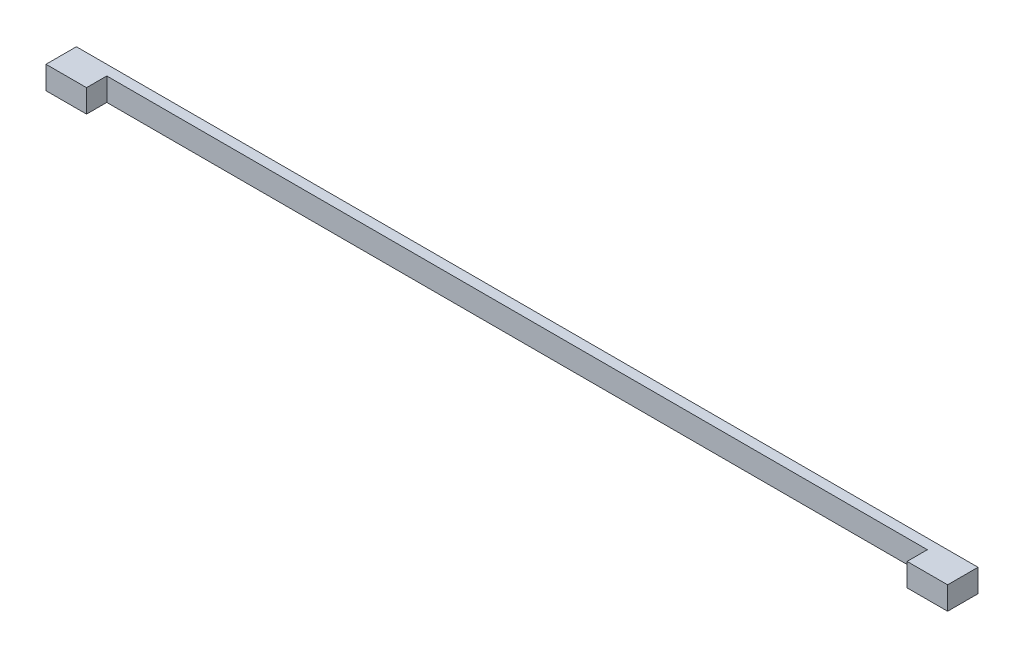
from build123d import *

# Parameters (mm, degrees)
SKETCH_1_W      = 445
SKETCH_1_H      = 11.320223532
EXTRUDE_1_DEPTH = 5
SKETCH_2_W      = 20
SKETCH_2_H      = 11.320223532
EXTRUDE_2_DEPTH = 10


with BuildPart() as part:
    # 스케치1 → 보스-돌출1 (new body)
    with BuildSketch(Plane.XY):
        Rectangle(SKETCH_1_W, SKETCH_1_H)
    extrude(amount=EXTRUDE_1_DEPTH)

    # 스케치2 → 보스-돌출2 (add)
    with BuildSketch(Plane.XY.offset(5)):
        with Locations((-212.5, 0)):
            Rectangle(SKETCH_2_W, SKETCH_2_H)
        with Locations((212.5, 0)):
            Rectangle(SKETCH_2_W, SKETCH_2_H)
    extrude(amount=EXTRUDE_2_DEPTH)


solid = part.part
